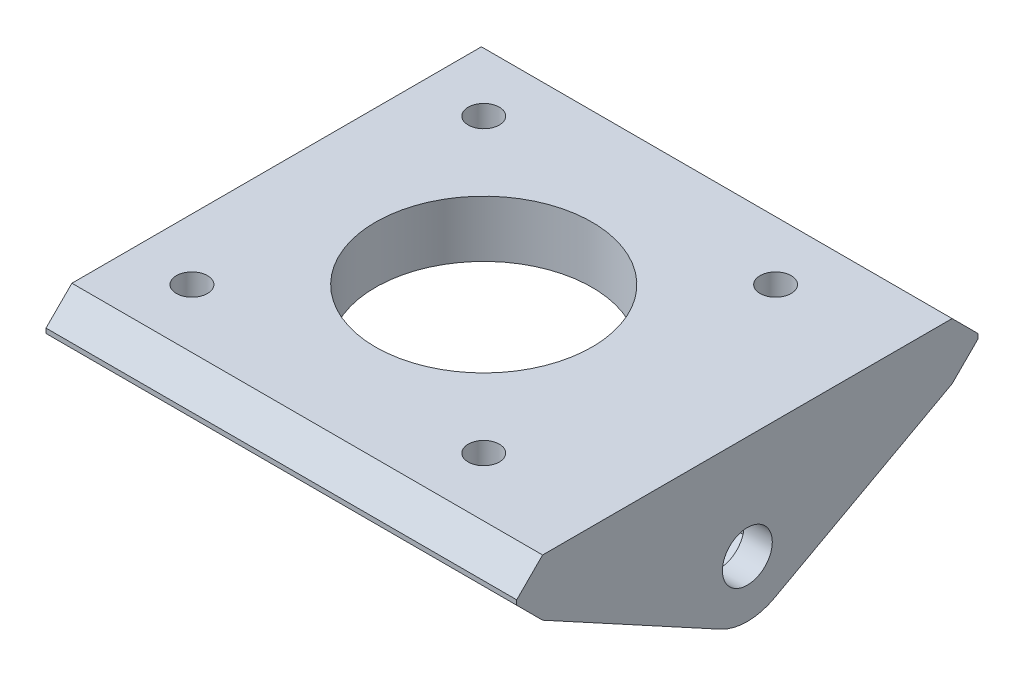
from build123d import *

# Parameters (mm, degrees)
SKETCH1_W           = 44
SKETCH1_H           = 49
SKETCH1_R           = 11.5
SKETCH1_R_2         = 1.65
BOSS_EXTRUDE1_DEPTH = 6
CHAMFER1_SIZE       = 2.75
BOSS_EXTRUDE2_DEPTH = 3
SKETCH3_R           = 2.65
BOSS_EXTRUDE3_DEPTH = 3
BOSS_EXTRUDE4_DEPTH = 6
FILLET1_R           = 2


with BuildPart() as part:
    # Sketch1 → Boss-Extrude1 (new body)
    with BuildSketch(Plane(origin=(0, 0, 0), x_dir=(1, 0, 0), z_dir=(0, 1, 0))):
        Rectangle(SKETCH1_W, SKETCH1_H)
        with Locations(Location((0, 0, 0), (0, 0, 270))):
            Circle(SKETCH1_R, mode=Mode.SUBTRACT)
        with Locations(Location((15.5, 15.5, 0), (0, 0, 270))):
            Circle(SKETCH1_R_2, mode=Mode.SUBTRACT)
        with Locations(Location((15.5, -15.5, 0), (0, 0, 270))):
            Circle(SKETCH1_R_2, mode=Mode.SUBTRACT)
        with Locations(Location((-15.5, -15.5, 0), (0, 0, 270))):
            Circle(SKETCH1_R_2, mode=Mode.SUBTRACT)
        with Locations(Location((-15.5, 15.5, 0), (0, 0, 270))):
            Circle(SKETCH1_R_2, mode=Mode.SUBTRACT)
    extrude(amount=BOSS_EXTRUDE1_DEPTH)

    # Chamfer1
    chamfer1_edges = [part.edges().sort_by_distance(p)[0] for p in [
        (0, 6, 24.5),
        (0, 0, 24.5),
        (0, 0, -24.5),
        (0, 6, -24.5),
    ]]
    chamfer(chamfer1_edges, length=CHAMFER1_SIZE)

    # Sketch2 → Boss-Extrude2 (add)
    with BuildSketch(Plane(origin=(22, 0, 0), x_dir=(0, 0, -1), z_dir=(1, 0, 0))):
        with BuildLine():
            Line((-21.75, 6), (21.75, 6))
            Line((21.75, 6), (21.75, 0))
            Line((21.75, 0), (2.866847379, -10.270786099))
            ThreePointArc((2.866847379, -10.270786099), (0, -11), (-2.866847379, -10.270786099))
            Line((-2.866847379, -10.270786099), (-21.75, 0))
            Line((-21.75, 0), (-21.75, 6))
        make_face()
        Polygon((0, -9.907477288), (4.25, -7.453738644), (4.25, -2.546261356), (0, -0.092522712), (-4.25, -2.546261356), (-4.25, -7.453738644), align=None, mode=Mode.SUBTRACT)
    extrude(amount=BOSS_EXTRUDE2_DEPTH)

    # Sketch3 → Boss-Extrude3 (add)
    # profile 1 of 2: a face of its own
    with BuildSketch(Plane(origin=(25, 0, 0), x_dir=(0, 0, -1), z_dir=(1, 0, 0))):
        with BuildLine():
            Line((21.75, 6), (-21.75, 6))
            Line((-21.75, 6), (-21.75, 0))
            Line((-21.75, 0), (-2.866847379, -10.270786099))
            ThreePointArc((-2.866847379, -10.270786099), (0, -11), (2.866847379, -10.270786099))
            Line((2.866847379, -10.270786099), (21.75, 0))
            Line((21.75, 0), (21.75, 6))
        make_face()
        Polygon((4.25, -2.546261356), (4.25, -7.453738644), (0, -9.907477288), (-4.25, -7.453738644), (-4.25, -2.546261356), (0, -0.092522712), align=None, mode=Mode.SUBTRACT)
    # profile 2 of 2: a face of its own
    with BuildSketch(Plane(origin=(25, 0, 0), x_dir=(0, 0, -1), z_dir=(1, 0, 0))):
        Polygon((4.25, -7.453738644), (0, -9.907477288), (-4.25, -7.453738644), (-4.25, -2.546261356), (0, -0.092522712), (4.25, -2.546261356), align=None)
        with Locations((0, -5)):
            Circle(SKETCH3_R, mode=Mode.SUBTRACT)
    extrude(amount=BOSS_EXTRUDE3_DEPTH)

    # Sketch4 → Boss-Extrude4 (add)
    with BuildSketch(Plane(origin=(22, 0, 0), x_dir=(0, 0, -1), z_dir=(1, 0, 0))):
        Polygon((-21.75, 0), (-21.75, 6), (-24.5, 3.25), (-24.5, 2.75), align=None)
        Polygon((21.75, 6), (21.75, 0), (24.5, 2.75), (24.5, 3.25), align=None)
    extrude(amount=BOSS_EXTRUDE4_DEPTH)

    # Fillet1
    fillet1_edges = [part.edges().sort_by_distance(p)[0] for p in [
        (0, 0, 21.75),
        (0, 0, -21.75),
    ]]
    fillet(fillet1_edges, radius=FILLET1_R)


solid = part.part
